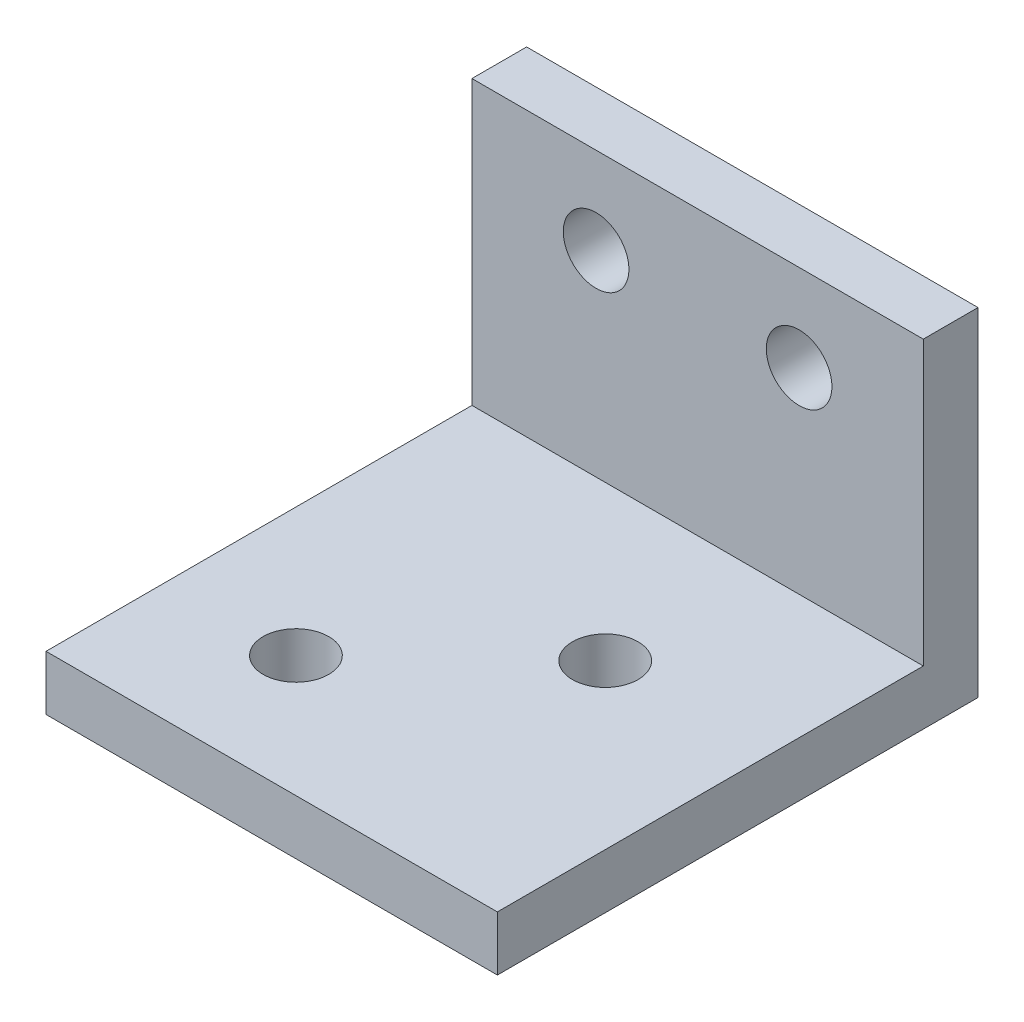
from build123d import *

# Parameters (mm, degrees)
SKETCH1_W           = 41.256811376
SKETCH1_H           = 15.875111739
SKETCH1_R           = 3
BOSS_EXTRUDE1_DEPTH = 5
SKETCH2_W           = 41.256811376
SKETCH2_H           = 15
BOSS_EXTRUDE3_DEPTH = 5
SKETCH3_W           = 41.256811376
SKETCH3_H           = 38.931242613
SKETCH3_R           = 3
BOSS_EXTRUDE5_DEPTH = 5


with BuildPart() as part:
    # Sketch1 → Boss-Extrude1 (new body)
    with BuildSketch(Plane.XY):
        with Locations((85.088811215, -27.526454456)):
            Rectangle(SKETCH1_W, SKETCH1_H)
        with Locations((94.366601686, -27.526454455)):
            Circle(SKETCH1_R, mode=Mode.SUBTRACT)
        with Locations((75.811020744, -27.526454455)):
            Circle(SKETCH1_R, mode=Mode.SUBTRACT)
    extrude(amount=BOSS_EXTRUDE1_DEPTH)

    # Sketch2 → Boss-Extrude3 (add)
    with BuildSketch(Plane.XY.offset(5)):
        with Locations((85.088811215, -42.964010325)):
            Rectangle(SKETCH2_W, SKETCH2_H)
    extrude(amount=-BOSS_EXTRUDE3_DEPTH)

    # Sketch3 → Boss-Extrude5 (add)
    with BuildSketch(Plane.XZ.offset(50.464010325)):
        with Locations((85.088811215, 24.465621307)):
            Rectangle(SKETCH3_W, SKETCH3_H)
        with Locations(Location((76.213848726, 32.840318874, 0), (0, 0, 270))):
            Circle(SKETCH3_R, mode=Mode.SUBTRACT)
        with Locations(Location((90.760010617, 19.114096734, 0), (0, 0, 270))):
            Circle(SKETCH3_R, mode=Mode.SUBTRACT)
    extrude(amount=-BOSS_EXTRUDE5_DEPTH)


solid = part.part
